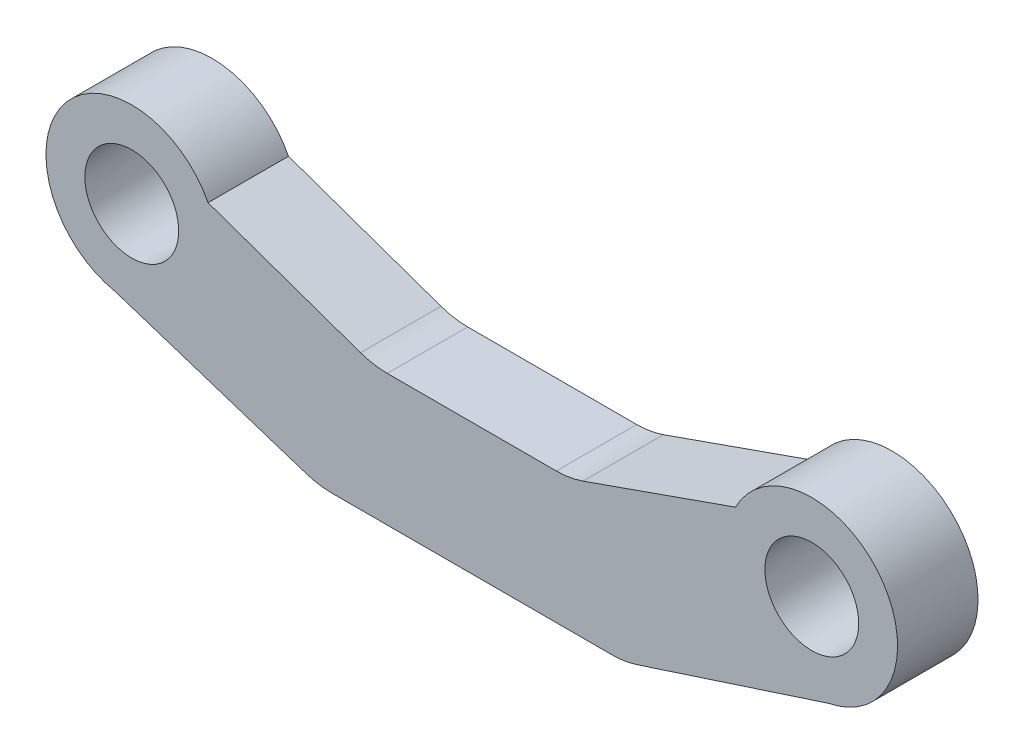
from build123d import *

# Parameters (mm, degrees)
CROQUIS1_R              = 1.75
SALIENTE_EXTRUIR1_DEPTH = 3


with BuildPart() as part:
    # Croquis1 → Saliente-Extruir1 (new body)
    with BuildSketch(Plane.XY):
        with BuildLine():
            Line((13.871153062, 23.274726508), (24.330135763, 23.274726508))
            ThreePointArc((24.330135763, 23.274726508), (24.799781514, 23.311715731), (25.257846044, 23.421771263))
            Line((25.257846044, 23.421771263), (32.405644412, 25.746057998))
            ThreePointArc((32.405644412, 25.746057998), (34.336780797, 30.811489821), (28.935644412, 30.347148308))
            Line((28.935644412, 30.347148308), (23.249258293, 28.345004197))
            ThreePointArc((23.249258293, 28.345004197), (22.758316719, 28.21760232), (22.252929212, 28.174726508))
            Line((22.252929212, 28.174726508), (15.948359613, 28.174726508))
            ThreePointArc((15.948359613, 28.174726508), (15.442972106, 28.21760232), (14.952030531, 28.345004197))
            Line((14.952030531, 28.345004197), (9.265644412, 30.347148308))
            ThreePointArc((9.265644412, 30.347148308), (3.864508027, 30.811489821), (5.795644412, 25.746057998))
            Line((5.795644412, 25.746057998), (12.94344278, 23.421771263))
            ThreePointArc((12.94344278, 23.421771263), (13.401507311, 23.311715731), (13.871153062, 23.274726508))
        make_face()
        with Locations((31.781902577, 28.88467969)):
            Circle(CROQUIS1_R, mode=Mode.SUBTRACT)
        with Locations(Location((6.419386247, 28.88467969, 0), (0, 0, 180))):
            Circle(CROQUIS1_R, mode=Mode.SUBTRACT)
    extrude(amount=SALIENTE_EXTRUIR1_DEPTH)


solid = part.part
